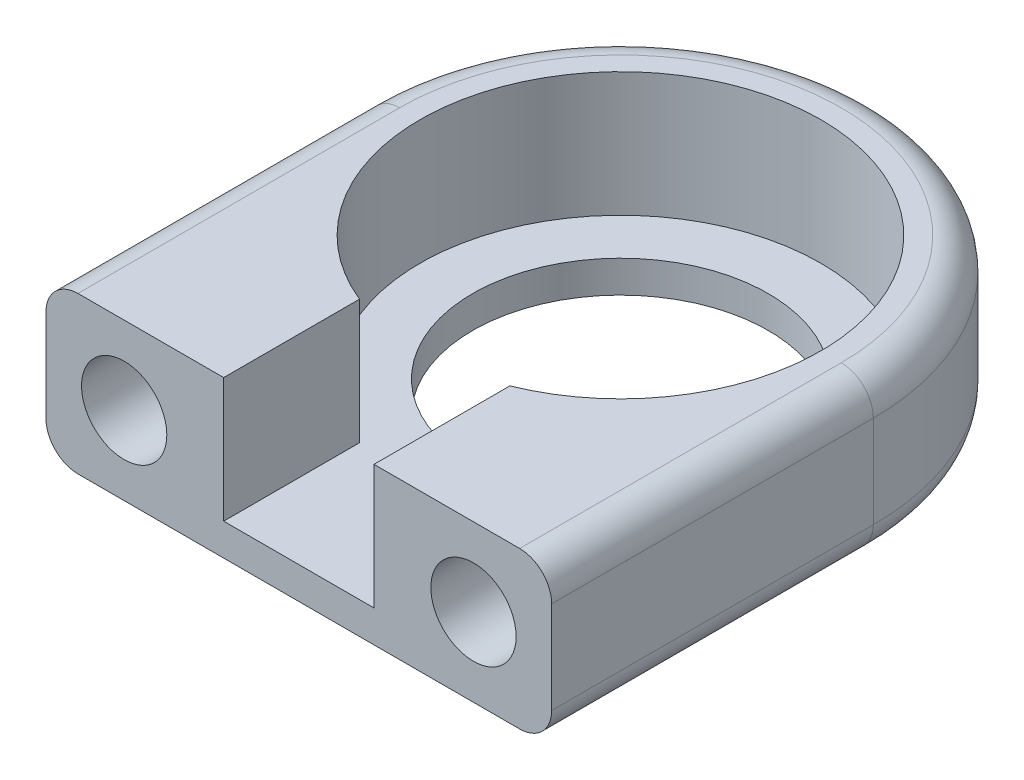
from build123d import *

# Parameters (mm, degrees)
SKETCH1_R           = 14.0975
BOSS_EXTRUDE1_DEPTH = 11
SKETCH4_R           = 14.0975
BOSS_EXTRUDE2_DEPTH = 2.25
SKETCH5_R           = 10.4
CUT_EXTRUDE1_DEPTH  = 2.25
SKETCH3_W           = 10.575
SKETCH3_H           = 12.228258218
CUT_EXTRUDE5_DEPTH  = 8.75
SKETCH6_R           = 3
CUT_EXTRUDE6_DEPTH  = 9
FILLET5_R           = 2.25
FILLET6_R           = 2.25


with BuildPart() as part:
    # Sketch1 → Boss-Extrude1 (new body)
    with BuildSketch(Plane(origin=(0, 0, 0), x_dir=(1, 0, 0), z_dir=(0, 1, 0))):
        with BuildLine():
            Line((-17.7875, -22.628070726), (17.7875, -22.628070726))
            Line((17.7875, -22.628070726), (17.7875, 0))
            ThreePointArc((17.7875, 0), (0, 17.7875), (-17.7875, 0))
            Line((-17.7875, 0), (-17.7875, -22.628070726))
        make_face()
        with Locations(Location((0, 0, 0), (0, 0, 270))):
            Circle(SKETCH1_R, mode=Mode.SUBTRACT)
    extrude(amount=BOSS_EXTRUDE1_DEPTH)

    # Sketch4 → Boss-Extrude2 (add)
    with BuildSketch(Plane.XZ):
        with Locations(Location((0, 0, 0), (0, 0, 270))):
            Circle(SKETCH4_R)
    extrude(amount=-BOSS_EXTRUDE2_DEPTH)

    # Sketch5 → Cut-Extrude1 (cut)
    with BuildSketch(Plane(origin=(0, 2.25, 0), x_dir=(1, 0, 0), z_dir=(0, 1, 0))):
        with Locations(Location((0, 0, 0), (0, 0, 270))):
            Circle(SKETCH5_R)
    extrude(amount=-CUT_EXTRUDE1_DEPTH, mode=Mode.SUBTRACT)

    # Sketch3 → Cut-Extrude5 (cut)
    with BuildSketch(Plane(origin=(0, 11, 0), x_dir=(1, 0, 0), z_dir=(0, 1, 0))):
        with Locations((0, -16.513941617)):
            Rectangle(SKETCH3_W, SKETCH3_H)
    extrude(amount=-CUT_EXTRUDE5_DEPTH, mode=Mode.SUBTRACT)

    # Sketch6 → Cut-Extrude6 (cut)
    with BuildSketch(Plane.XY.offset(22.628070726)):
        with Locations((-12.2875, 5.5)):
            Circle(SKETCH6_R)
        with Locations((12.2875, 5.5)):
            Circle(SKETCH6_R)
    extrude(amount=-CUT_EXTRUDE6_DEPTH, mode=Mode.SUBTRACT)

    # Fillet5
    fillet5_edges = [part.edges().sort_by_distance(p)[0] for p in [
        (17.7875, 0, 11.314035363),
        (-17.7875, 0, 11.314035363),
        (0, 0, -17.7875),
    ]]
    fillet(fillet5_edges, radius=FILLET5_R)

    # Fillet6
    fillet6_edges = [part.edges().sort_by_distance(p)[0] for p in [
        (17.7875, 11, 11.314035363),
        (0, 11, -17.7875),
        (-17.7875, 11, 11.314035363),
    ]]
    fillet(fillet6_edges, radius=FILLET6_R)


solid = part.part
